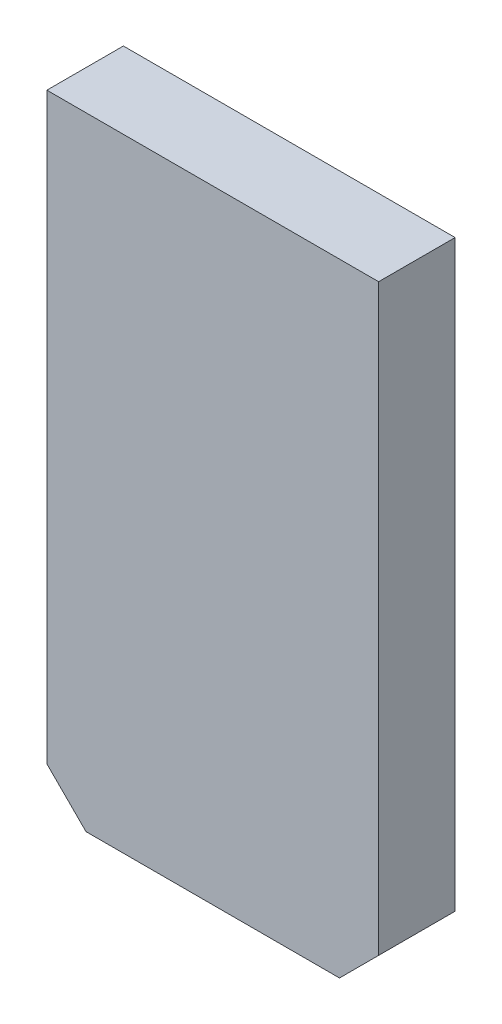
from build123d import *

# Parameters (mm, degrees)
BOSS_EXTRUDE1_DEPTH = 0.86


with BuildPart() as part:
    # Sketch1 → Boss-Extrude1 (new body)
    with BuildSketch(Plane(origin=(0, 0, 0), x_dir=(-1, 0, 0), z_dir=(0, 0, -1))):
        Polygon((-8.738603111, 0.108213984), (-5.888603111, 0.108213984), (-5.448603111, 0.548213984), (-5.448603111, 7.108213984), (-9.178603111, 7.108213984), (-9.178603111, 0.548213984), align=None)
    extrude(amount=BOSS_EXTRUDE1_DEPTH)


solid = part.part
